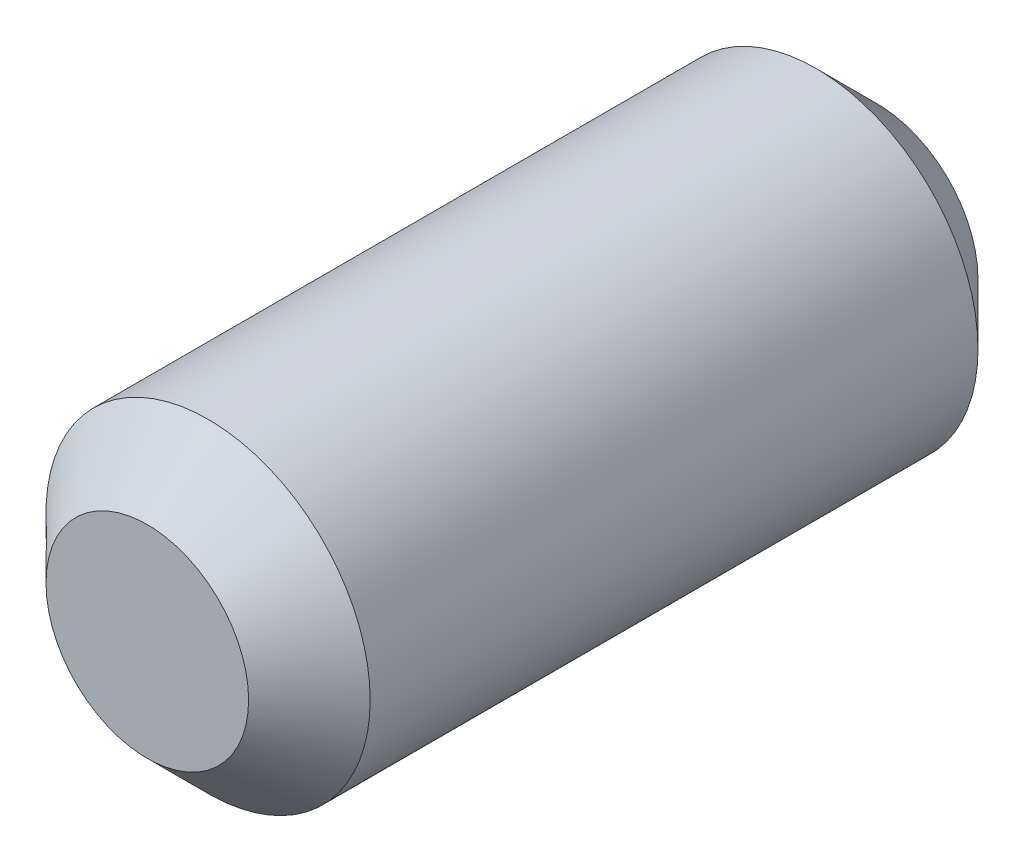
from build123d import *

# Parameters (mm, degrees)
SKETCH_1_R      = 4
EXTRUDE_1_DEPTH = 18
CHAMFER_1_SIZE  = 1.5


with BuildPart() as part:
    # Эскиз1 → Вытянуть1 (new body)
    with BuildSketch(Plane.XY):
        Circle(SKETCH_1_R)
    extrude(amount=EXTRUDE_1_DEPTH)

    # Фаска1
    chamfer_1_edges = [part.edges().sort_by_distance(p)[0] for p in [
        (-4, 0, 0),
        (-4, 0, 18),
    ]]
    chamfer(chamfer_1_edges, length=CHAMFER_1_SIZE)


solid = part.part
